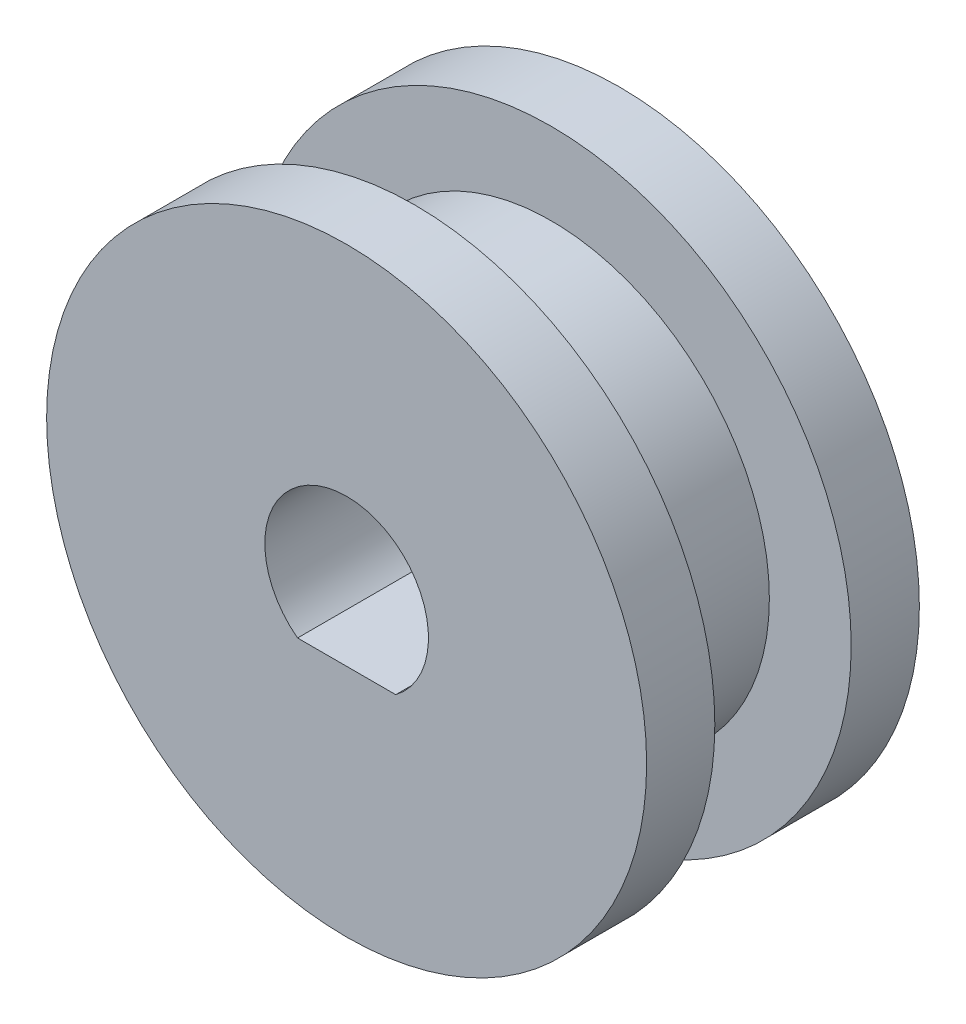
from build123d import *

# Parameters (mm, degrees)
SKETCH1_R           = 11
BOSS_EXTRUDE1_DEPTH = 10
SKETCH2_W           = 3
SKETCH2_H           = 5


with BuildPart() as part:
    # Sketch1 → Boss-Extrude1 (new body)
    with BuildSketch(Plane.XY):
        Circle(SKETCH1_R)
        with BuildLine():
            ThreePointArc((1.8, -2.4), (0, 3), (-1.8, -2.4))
            Line((-1.8, -2.4), (1.8, -2.4))
        make_face(mode=Mode.SUBTRACT)
    extrude(amount=BOSS_EXTRUDE1_DEPTH)

    # Sketch2 → Cut-Revolve1 (revolve, cut)
    with BuildSketch(Plane(origin=(0, 0, 0), x_dir=(1, 0, 0), z_dir=(0, 1, 0))):
        with Locations((-9.5, -5)):
            Rectangle(SKETCH2_W, SKETCH2_H)
    revolve(axis=Axis((0, 0, 0), (0, 0, 1)), mode=Mode.SUBTRACT)


solid = part.part
